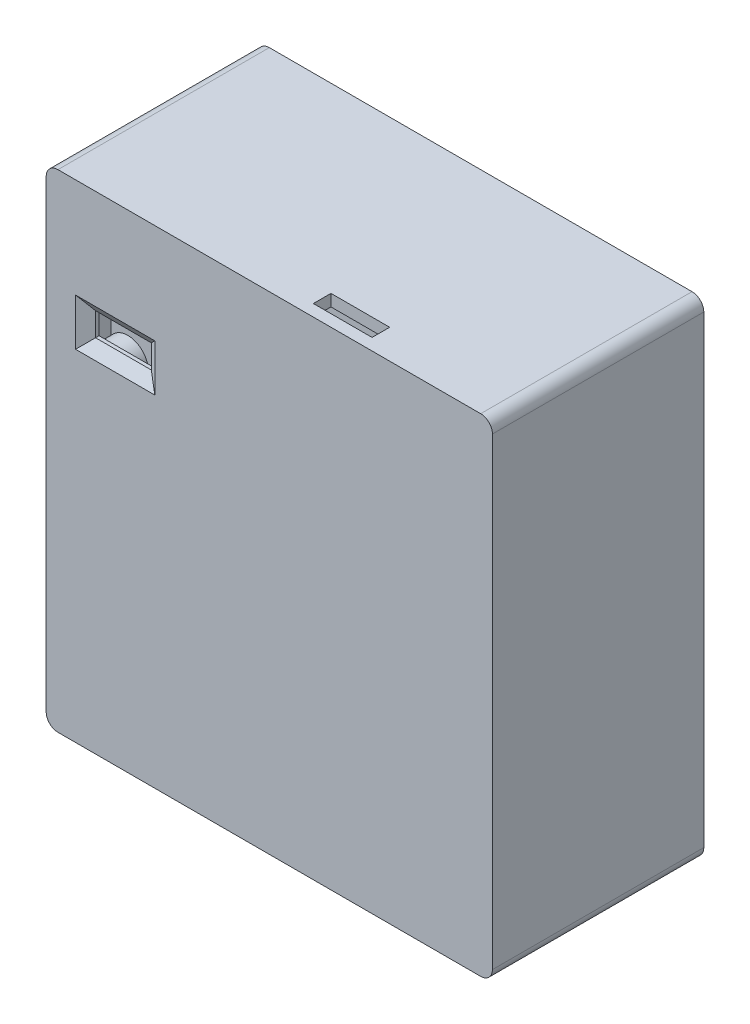
from build123d import *

# Parameters (mm, degrees)
BOSS_EXTRUDE2_DEPTH      = 39.5
BOSS_EXTRUDE2_DEPTH_BACK = 39.5
SKETCH1_W                = 76
SKETCH1_H                = 36
SKETCH1_W_2              = 72
SKETCH1_H_2              = 32
SKETCH2_W                = 76
SKETCH2_H                = 36
BOSS_EXTRUDE3_DEPTH      = 2
BOSS_EXTRUDE4_DEPTH      = 10
BOSS_EXTRUDE4_DEPTH_BACK = 10
SKETCH6_W                = 70
SKETCH6_H                = 70
FILLET1_R                = 2
SKETCH7_W                = 2
SKETCH7_H                = 10
SKETCH7_W_2              = 10
SKETCH7_H_2              = 2
CUT_EXTRUDE1_DEPTH       = 3
SKETCH8_R                = 6.5
CUT_EXTRUDE2_DEPTH       = 2
SKETCH9_W                = 20
SKETCH9_H                = 7
SKETCH9_W_2              = 25
SKETCH9_W_3              = 7
SKETCH9_H_2              = 20
BOSS_EXTRUDE5_DEPTH      = 10
SKETCH10_W               = 9.5
SKETCH10_H               = 4
CUT_EXTRUDE3_DEPTH       = 2
CHAMFER1_SIZE            = 2
CHAMFER1_SIZE2           = 1.400415076
SKETCH11_R               = 3.5
SKETCH11_R_2             = 1.5
BOSS_EXTRUDE10_DEPTH     = 7.3


with BuildPart() as part:
    # Sketch1 → Boss-Extrude2 (new, two sides: drawn at the far end of the back side and taken through both)
    with BuildSketch(Plane(origin=(0, 0, 0), x_dir=(1, 0, 0), z_dir=(0, 1, 0)).offset(-BOSS_EXTRUDE2_DEPTH_BACK)):
        Rectangle(SKETCH1_W, SKETCH1_H)
        Rectangle(SKETCH1_W_2, SKETCH1_H_2, mode=Mode.SUBTRACT)
    extrude(amount=BOSS_EXTRUDE2_DEPTH + BOSS_EXTRUDE2_DEPTH_BACK)

    # Sketch2 → Boss-Extrude3 (add)
    with BuildSketch(Plane.XZ.offset(39.5)):
        Rectangle(SKETCH2_W, SKETCH2_H)
    boss_extrude3 = extrude(amount=BOSS_EXTRUDE3_DEPTH)

    # Mirror1: Boss-Extrude3 across plane
    add(boss_extrude3.mirror(Plane.ZX))

    # Fillet1
    fillet1_edges = [part.edges().sort_by_distance(p)[0] for p in [
        (38, -41.5, 0),
        (-38, -41.5, 0),
        (38, 41.5, 0),
        (-38, 41.5, 0),
    ]]
    fillet(fillet1_edges, radius=FILLET1_R)

    # Sketch7 → Cut-Extrude1 (cut)
    with BuildSketch(Plane.XY.offset(16)):
        with Locations((-37, -12)):
            Rectangle(SKETCH7_W, SKETCH7_H)
        with Locations((10.5, 40.5)):
            Rectangle(SKETCH7_W_2, SKETCH7_H_2)
    extrude(amount=-CUT_EXTRUDE1_DEPTH, mode=Mode.SUBTRACT)

    # Sketch8 → Cut-Extrude2 (cut)
    with BuildSketch(Plane.ZY.offset(38)):
        with Locations((-6, 8)):
            Circle(SKETCH8_R)
    extrude(amount=-CUT_EXTRUDE2_DEPTH, mode=Mode.SUBTRACT)

    # Sketch9 → Boss-Extrude5 (add)
    with BuildSketch(Plane.XY.offset(-16)):
        with Locations((-16.5, 23.5)):
            Rectangle(SKETCH9_W, SKETCH9_H)
        with Locations((-14, -24)):
            Rectangle(SKETCH9_W_2, SKETCH9_H)
        with Locations((4.5, -0.25)):
            Rectangle(SKETCH9_W_3, SKETCH9_H_2)
    extrude(amount=BOSS_EXTRUDE5_DEPTH)

    # Sketch10 → Cut-Extrude3 (cut)
    with BuildSketch(Plane.XY.offset(18)):
        with Locations((-26.25, 20.5)):
            Rectangle(SKETCH10_W, SKETCH10_H)
    extrude(amount=-CUT_EXTRUDE3_DEPTH, mode=Mode.SUBTRACT)

    # Chamfer1
    chamfer1_edges = [part.edges().sort_by_distance(p)[0] for p in [
        (-21.5, 20.5, 18),
        (-26.25, 22.5, 18),
        (-31, 20.5, 18),
        (-26.25, 18.5, 18),
    ]]
    chamfer1_side = [part.faces().sort_by_distance(p)[0] for p in [
        (0.15917808, -0.1243105, 18),
    ]]
    chamfer(chamfer1_edges, length=CHAMFER1_SIZE, length2=CHAMFER1_SIZE2, reference=chamfer1_side[0])

    # Sketch11 → Boss-Extrude10 (add)
    # profile 1 of 3: a face of its own
    with BuildSketch(Plane(origin=(0, 0, 16), x_dir=(-1, 0, 0), z_dir=(0, 0, -1))):
        with Locations(Location((32.1, 11.5, 0), (0, 0, 180))):
            Circle(SKETCH11_R)
        with Locations((32.1, 11.5)):
            Circle(SKETCH11_R_2, mode=Mode.SUBTRACT)
    # profile 2 of 3: a face of its own
    with BuildSketch(Plane(origin=(0, 0, 16), x_dir=(-1, 0, 0), z_dir=(0, 0, -1))):
        with Locations(Location((-32.4, -33.5, 0), (0, 0, 180))):
            Circle(SKETCH11_R)
        with Locations((-32.4, -33.5)):
            Circle(SKETCH11_R_2, mode=Mode.SUBTRACT)
    # profile 3 of 3: a face of its own
    with BuildSketch(Plane(origin=(0, 0, 16), x_dir=(-1, 0, 0), z_dir=(0, 0, -1))):
        with Locations(Location((-32.4, 11.5, 0), (0, 0, 180))):
            Circle(SKETCH11_R)
        with Locations((-32.4, 11.5)):
            Circle(SKETCH11_R_2, mode=Mode.SUBTRACT)
    extrude(amount=BOSS_EXTRUDE10_DEPTH)


with BuildPart() as body_2:
    # Sketch6 → Boss-Extrude4 (new, two sides: drawn at the far end of the back side and taken through both)
    with BuildSketch(Plane.XY.offset(-BOSS_EXTRUDE4_DEPTH_BACK)):
        with Locations((0, 3.5)):
            Rectangle(SKETCH6_W, SKETCH6_H)
    extrude(amount=BOSS_EXTRUDE4_DEPTH + BOSS_EXTRUDE4_DEPTH_BACK)


solid = Compound([part.part, body_2.part])
